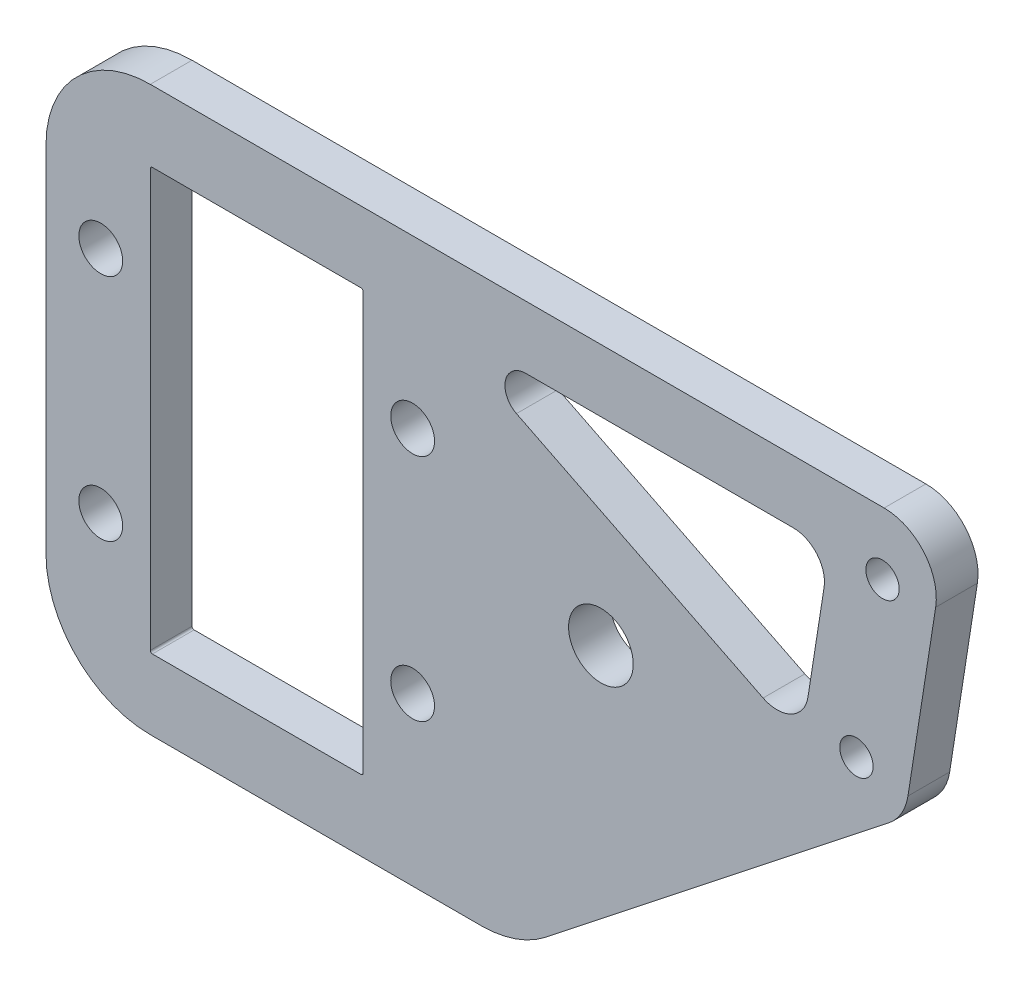
from build123d import *

# Parameters (mm, degrees)
SKETCH_1_R          = 3.1
SKETCH_1_R_2        = 1.6
SKETCH_1_W          = 20.4
SKETCH_1_H          = 40.4
EXTRUDE_1_DEPTH     = 4
FILLET_1_R          = 0.2
SKETCH_2_R          = 2.1
CUT_EXTRUDE_1_DEPTH = 4
CUT_EXTRUDE_2_DEPTH = 10


with BuildPart() as part:
    # 草图1 → 凸台-拉伸1 (new body)
    with BuildSketch(Plane.XY):
        with BuildLine():
            Line((-10.2, 27), (60.15625, 27))
            ThreePointArc((60.15625, 27), (63.954895943, 25.251198086), (65.096310169, 21.228115599))
            Line((65.096310169, 21.228115599), (62.440060169, 4.228115599))
            ThreePointArc((62.440060169, 4.228115599), (61.816569536, 2.476663431), (60.596300169, 1.074070141))
            Line((60.596300169, 1.074070141), (27.72371786, -24.851859719))
            ThreePointArc((27.72371786, -24.851859719), (24.808418455, -26.447713935), (21.531117522, -27))
            Line((21.531117522, -27), (-10.2, -27))
            ThreePointArc((-10.2, -27), (-17.271067812, -24.071067812), (-20.2, -17))
            Line((-20.2, -17), (-20.2, 17))
            ThreePointArc((-20.2, 17), (-17.271067812, 24.071067812), (-10.2, 27))
        make_face()
        with Locations((33, 2)):
            Circle(SKETCH_1_R, mode=Mode.SUBTRACT)
        with Locations((60, 21)):
            Circle(SKETCH_1_R_2, mode=Mode.SUBTRACT)
        with Locations((57.5, 5)):
            Circle(SKETCH_1_R_2, mode=Mode.SUBTRACT)
        Rectangle(SKETCH_1_W, SKETCH_1_H, mode=Mode.SUBTRACT)
    extrude(amount=EXTRUDE_1_DEPTH)

    # 圆角1
    fillet_1_edges = [part.edges().sort_by_distance(p)[0] for p in [
        (-10.2, 20.2, 2),
        (-10.2, -20.2, 2),
        (10.2, -20.2, 2),
        (10.2, 20.2, 2),
    ]]
    fillet(fillet_1_edges, radius=FILLET_1_R)

    # 草图2 → 切除-拉伸1 (cut)
    with BuildSketch(Plane.XY.offset(4)):
        with Locations((14.95, 11)):
            Circle(SKETCH_2_R)
        with Locations(Location((14.95, -11, 0), (0, 0, 180))):
            Circle(SKETCH_2_R)
        with Locations((-14.95, -11)):
            Circle(SKETCH_2_R)
        with Locations(Location((-14.95, 11, 0), (0, 0, 180))):
            Circle(SKETCH_2_R)
    extrude(amount=-CUT_EXTRUDE_1_DEPTH, mode=Mode.SUBTRACT)

    # 草图3 → 切除-拉伸2 (cut)
    with BuildSketch(Plane.XY.offset(4)):
        with BuildLine():
            Line((25.798016292, 21), (51.43418263, 21))
            ThreePointArc((51.43418263, 21), (53.713370196, 19.950718852), (54.398218731, 17.536869359))
            Line((54.398218731, 17.536869359), (52.852232934, 7.642560256))
            ThreePointArc((52.852232934, 7.642560256), (51.264559821, 5.440053089), (48.549531682, 5.420923567))
            Line((48.549531682, 5.420923567), (24.905572858, 17.210155114))
            ThreePointArc((24.905572858, 17.210155114), (23.851263897, 19.458426781), (25.798016292, 21))
        make_face()
    extrude(amount=-CUT_EXTRUDE_2_DEPTH, mode=Mode.SUBTRACT)


solid = part.part
